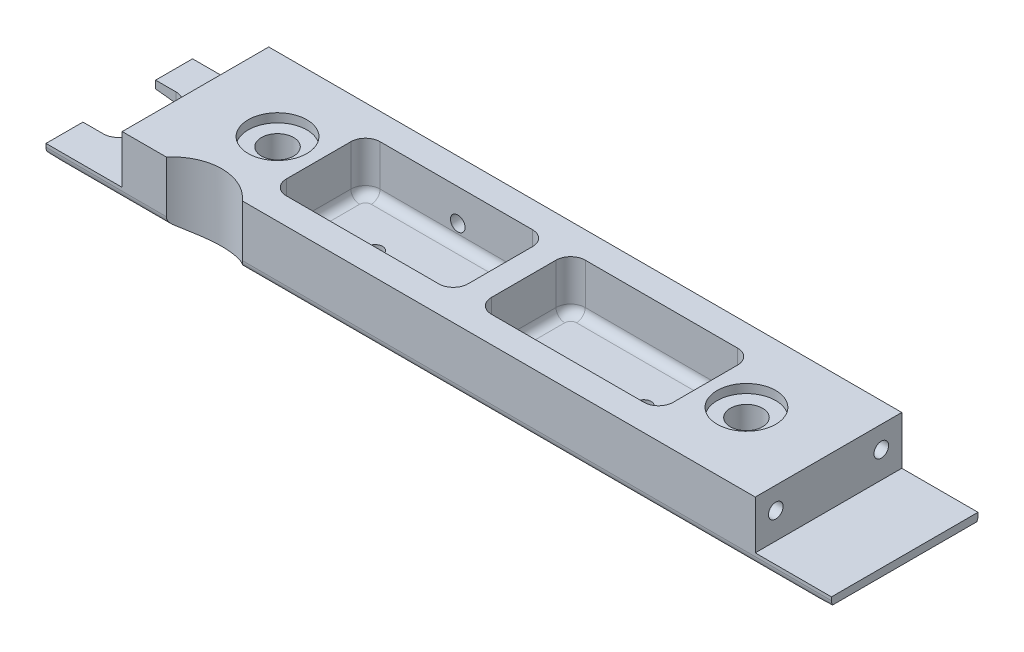
from build123d import *

# Parameters (mm, degrees)
EXTRUDE_1_DEPTH        = 50
SKETCH_2_OUTSIDE_W     = 106.754
SKETCH_2_OUTSIDE_H     = 81.754
CUT_EXTRUDE_4_DEPTH    = 1077.72469526
CUT_EXTRUDE_5_DEPTH    = 17
FILLET_1_R             = 3
SKETCH_4_R             = 5.5
CUT_EXTRUDE_6_DEPTH    = 1236.559793023
SKETCH_5_R             = 10
CUT_EXTRUDE_7_DEPTH    = 3
SKETCH_6_R             = 8.5
CUT_EXTRUDE_8_DEPTH    = 14
SKETCH_7_R             = 2.5
CUT_EXTRUDE_9_DEPTH    = 21
SKETCH_8_R             = 17
CUT_EXTRUDE_10_DEPTH   = 1236.559793021
HOLE_WIZARD_M6_1_D     = 5
HOLE_WIZARD_M6_1_DEPTH = 15
HOLE_WIZARD_M6_1_TIP   = 1.502151548
HOLE_WIZARD_M6_2_D     = 5
HOLE_WIZARD_M6_2_DEPTH = 15
HOLE_WIZARD_M6_2_TIP   = 1.502151548
CUT_EXTRUDE_1_DEPTH    = 10


with BuildPart() as part:
    # 草图1 → 拉伸1 (new body)
    with BuildSketch(Plane.XY):
        with BuildLine():
            Line((992.294665047, 1041.639126273), (1208.294665047, 1041.639126273))
            Line((1208.294665047, 1041.639126273), (1208.294665047, 1025.139126273))
            Line((1208.294665047, 1025.139126273), (1234.294665047, 1025.139126273))
            Line((1234.294665047, 1025.139126273), (1234.294665047, 1022.526415282))
            ThreePointArc((1234.294665047, 1022.526415282), (1198.180357572, 1019.031385771), (1161.975855768, 1016.645492906))
            ThreePointArc((1161.975855768, 1016.645492906), (1161.849775162, 1016.640718185), (1161.723614222, 1016.639126273))
            Line((1161.723614222, 1016.639126273), (1038.865715872, 1016.639126273))
            ThreePointArc((1038.865715872, 1016.639126273), (1038.739554932, 1016.640718185), (1038.613474326, 1016.645492906))
            ThreePointArc((1038.613474326, 1016.645492906), (1002.408972522, 1019.031385771), (966.294665047, 1022.526415282))
            Line((966.294665047, 1022.526415282), (966.294665047, 1025.139126273))
            Line((966.294665047, 1025.139126273), (992.294665047, 1025.139126273))
            Line((992.294665047, 1025.139126273), (992.294665047, 1041.639126273))
        make_face()
    extrude(amount=EXTRUDE_1_DEPTH)

    # 草图2 outside → 拉伸4 (cut, through all)
    with BuildSketch(Plane(origin=(1234.294665047, 0, 0), x_dir=(0, 0, -1), z_dir=(1, 0, 0))):
        with Locations((-25, 1029.139)):
            Rectangle(SKETCH_2_OUTSIDE_W, SKETCH_2_OUTSIDE_H)
        with BuildLine():
            Line((-38.192024547, 1016.645492906), (-11.807975453, 1016.645492906))
            ThreePointArc((-11.807975453, 1016.645492906), (-10.977687339, 1016.714912652), (-10.17045458, 1016.921244247))
            ThreePointArc((-10.17045458, 1016.921244247), (-5.531256425, 1018.923022672), (-1.236337887, 1021.584404105))
            ThreePointArc((-1.236337887, 1021.584404105), (-0.326894471, 1022.64942969), (0, 1024.011232477))
            Line((0, 1024.011232477), (0, 1041.639126273))
            Line((0, 1041.639126273), (-50, 1041.639126273))
            Line((-50, 1041.639126273), (-50, 1024.011232477))
            ThreePointArc((-50, 1024.011232477), (-49.673105529, 1022.64942969), (-48.763662113, 1021.584404105))
            ThreePointArc((-48.763662113, 1021.584404105), (-44.468743575, 1018.923022672), (-39.82954542, 1016.921244247))
            ThreePointArc((-39.82954542, 1016.921244247), (-39.022312661, 1016.714912652), (-38.192024547, 1016.645492906))
        make_face(mode=Mode.SUBTRACT)
    extrude(amount=-CUT_EXTRUDE_4_DEPTH, mode=Mode.SUBTRACT)

    # 草图3 → 拉伸5 (cut)
    with BuildSketch(Plane(origin=(0, 1041.639126273, 0), x_dir=(1, 0, 0), z_dir=(0, 1, 0))):
        with BuildLine():
            Line((1039.294665047, -41), (1091.294665047, -41))
            ThreePointArc((1091.294665047, -41), (1094.830198953, -39.535533906), (1096.294665047, -36))
            Line((1096.294665047, -36), (1096.294665047, -14))
            ThreePointArc((1096.294665047, -14), (1094.830198953, -10.464466094), (1091.294665047, -9))
            Line((1091.294665047, -9), (1039.294665047, -9))
            ThreePointArc((1039.294665047, -9), (1035.759131141, -10.464466094), (1034.294665047, -14))
            Line((1034.294665047, -14), (1034.294665047, -36))
            ThreePointArc((1034.294665047, -36), (1035.759131141, -39.535533906), (1039.294665047, -41))
        make_face()
        with BuildLine():
            Line((1104.294665047, -36), (1104.294665047, -14))
            ThreePointArc((1104.294665047, -14), (1105.759131141, -10.464466094), (1109.294665047, -9))
            Line((1109.294665047, -9), (1161.294665047, -9))
            ThreePointArc((1161.294665047, -9), (1164.830198953, -10.464466094), (1166.294665047, -14))
            Line((1166.294665047, -14), (1166.294665047, -36))
            ThreePointArc((1166.294665047, -36), (1164.830198953, -39.535533906), (1161.294665047, -41))
            Line((1161.294665047, -41), (1109.294665047, -41))
            ThreePointArc((1109.294665047, -41), (1105.759131141, -39.535533906), (1104.294665047, -36))
        make_face()
    extrude(amount=-CUT_EXTRUDE_5_DEPTH, mode=Mode.SUBTRACT)

    # 圆角1
    fillet_1_edges = [part.edges().sort_by_distance(p)[0] for p in [
        (1035.759131141, 1024.639126273, 10.464466094),
        (1065.294665047, 1024.639126273, 9),
        (1094.830198953, 1024.639126273, 10.464466094),
        (1096.294665047, 1024.639126273, 25),
        (1094.830198953, 1024.639126273, 39.535533906),
        (1065.294665047, 1024.639126273, 41),
        (1035.759131141, 1024.639126273, 39.535533906),
        (1034.294665047, 1024.639126273, 25),
        (1105.759131141, 1024.639126273, 10.464466094),
        (1135.294665047, 1024.639126273, 9),
        (1164.830198953, 1024.639126273, 10.464466094),
        (1166.294665047, 1024.639126273, 25),
        (1164.830198953, 1024.639126273, 39.535533906),
        (1135.294665047, 1024.639126273, 41),
        (1105.759131141, 1024.639126273, 39.535533906),
        (1104.294665047, 1024.639126273, 25),
    ]]
    fillet(fillet_1_edges, radius=FILLET_1_R)

    # 草图4 → 拉伸6 (cut, through all)
    with BuildSketch(Plane(origin=(0, 1041.639126273, 0), x_dir=(1, 0, 0), z_dir=(0, 1, 0))):
        with Locations(Location((1020.294665047, -25, 0), (0, 0, 270))):
            Circle(SKETCH_4_R)
        with Locations(Location((1180.294665047, -25, 0), (0, 0, 270))):
            Circle(SKETCH_4_R)
    extrude(amount=-CUT_EXTRUDE_6_DEPTH, mode=Mode.SUBTRACT)

    # 草图5 → 拉伸7 (cut)
    with BuildSketch(Plane(origin=(0, 1041.639126273, 0), x_dir=(1, 0, 0), z_dir=(0, 1, 0))):
        with Locations(Location((1020.294665047, -25, 0), (0, 0, 270))):
            Circle(SKETCH_5_R)
        with Locations(Location((1180.294665047, -25, 0), (0, 0, 270))):
            Circle(SKETCH_5_R)
    extrude(amount=-CUT_EXTRUDE_7_DEPTH, mode=Mode.SUBTRACT)

    # 草图6 → 拉伸8 (cut)
    with BuildSketch(Plane.XZ.offset(-1016.645492906)):
        with Locations(Location((1180.294665047, 25, 0), (0, 0, 270))):
            Circle(SKETCH_6_R)
        with Locations(Location((1020.294665047, 25, 0), (0, 0, 270))):
            Circle(SKETCH_6_R)
    extrude(amount=-CUT_EXTRUDE_8_DEPTH, mode=Mode.SUBTRACT)

    # 草图7 → 拉伸9 (cut)
    with BuildSketch(Plane.ZY.offset(-992.294665047)):
        with Locations((7, 1034.139126273)):
            Circle(SKETCH_7_R)
        with Locations((43, 1034.139126273)):
            Circle(SKETCH_7_R)
    cut_extrude_9 = extrude(amount=-CUT_EXTRUDE_9_DEPTH, mode=Mode.SUBTRACT)

    # 镜向1: 拉伸9 across plane
    add(cut_extrude_9.mirror(Plane.ZY.offset(-1100.294665047)), mode=Mode.SUBTRACT)

    # 草图8 → 拉伸10 (cut, through all)
    with BuildSketch(Plane.XZ.offset(-1016.645492906)):
        with Locations((1020.294665047, 61)):
            Circle(SKETCH_8_R)
    extrude(amount=-CUT_EXTRUDE_10_DEPTH, mode=Mode.SUBTRACT)

    # M6 螺纹孔1
    with Locations(Plane(origin=(0, 0, 0), x_dir=(-1, 0, 0), z_dir=(0, 0, -1))):
        with Locations((-1065.794665047, 1030.743494944), (-1165.794665047, 1030.743494944)):
            Hole(HOLE_WIZARD_M6_1_D / 2, depth=HOLE_WIZARD_M6_1_DEPTH)
            with Locations((0, 0, -(HOLE_WIZARD_M6_1_DEPTH + HOLE_WIZARD_M6_1_TIP / 2))):  # 118° drill point
                Cone(0, HOLE_WIZARD_M6_1_D / 2, HOLE_WIZARD_M6_1_TIP, mode=Mode.SUBTRACT)

    # M6 螺纹孔2
    with Locations(Plane.XZ.offset(-1016.645492906)):
        with Locations((1053.613474326, 25), (1145.294665047, 25)):
            Hole(HOLE_WIZARD_M6_2_D / 2, depth=HOLE_WIZARD_M6_2_DEPTH)
            with Locations((0, 0, -(HOLE_WIZARD_M6_2_DEPTH + HOLE_WIZARD_M6_2_TIP / 2))):  # 118° drill point
                Cone(0, HOLE_WIZARD_M6_2_D / 2, HOLE_WIZARD_M6_2_TIP, mode=Mode.SUBTRACT)

    # 草图14 → 切除-拉伸1 (cut)
    with BuildSketch(Plane(origin=(0, 1025.139126273, 0), x_dir=(1, 0, 0), z_dir=(0, 1, 0))):
        with BuildLine():
            Line((978.294665047, -17.153430402), (978.294665047, -32.846569598))
            ThreePointArc((978.294665047, -32.846569598), (976.676000893, -36.091056093), (973.294665047, -37.4))
            Line((973.294665047, -37.4), (966.294665047, -37.4))
            Line((966.294665047, -37.4), (966.294665047, -12.6))
            Line((966.294665047, -12.6), (973.294665047, -12.6))
            ThreePointArc((973.294665047, -12.6), (976.676000893, -13.908943907), (978.294665047, -17.153430402))
        make_face()
    extrude(amount=-CUT_EXTRUDE_1_DEPTH, mode=Mode.SUBTRACT)


solid = part.part
